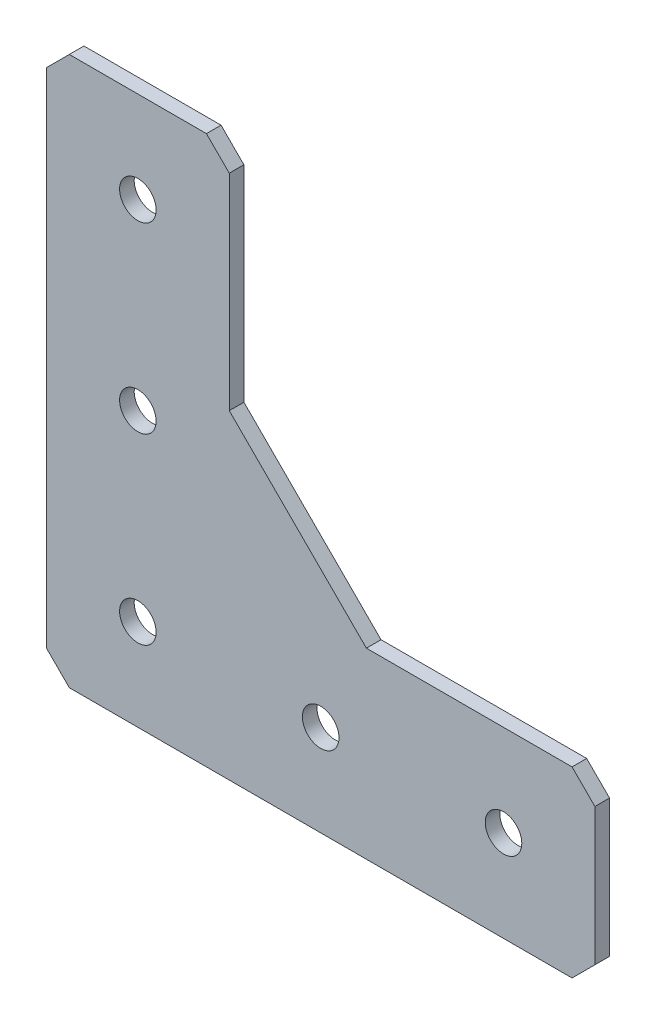
from build123d import *

# Parameters (mm, degrees)
SKETCH1_R           = 2.54
BOSS_EXTRUDE1_DEPTH = 1.016


with BuildPart() as part:
    # Sketch1 → Boss-Extrude1 (new, symmetric)
    with BuildSketch(Plane.XY):
        Polygon((76.2, 3.175), (76.2, 22.225), (73.025, 25.4), (44.45, 25.4), (25.4, 44.45), (25.4, 73.025), (22.225, 76.2), (3.175, 76.2), (0, 73.025), (0, 3.175), (3.175, 0), (73.025, 0), align=None)
        with Locations((12.7, 12.7)):
            Circle(SKETCH1_R, mode=Mode.SUBTRACT)
        with Locations((12.7, 38.1)):
            Circle(SKETCH1_R, mode=Mode.SUBTRACT)
        with Locations((12.7, 63.5)):
            Circle(SKETCH1_R, mode=Mode.SUBTRACT)
        with Locations((38.1, 12.7)):
            Circle(SKETCH1_R, mode=Mode.SUBTRACT)
        with Locations((63.5, 12.7)):
            Circle(SKETCH1_R, mode=Mode.SUBTRACT)
    extrude(amount=BOSS_EXTRUDE1_DEPTH, both=True)


solid = part.part
